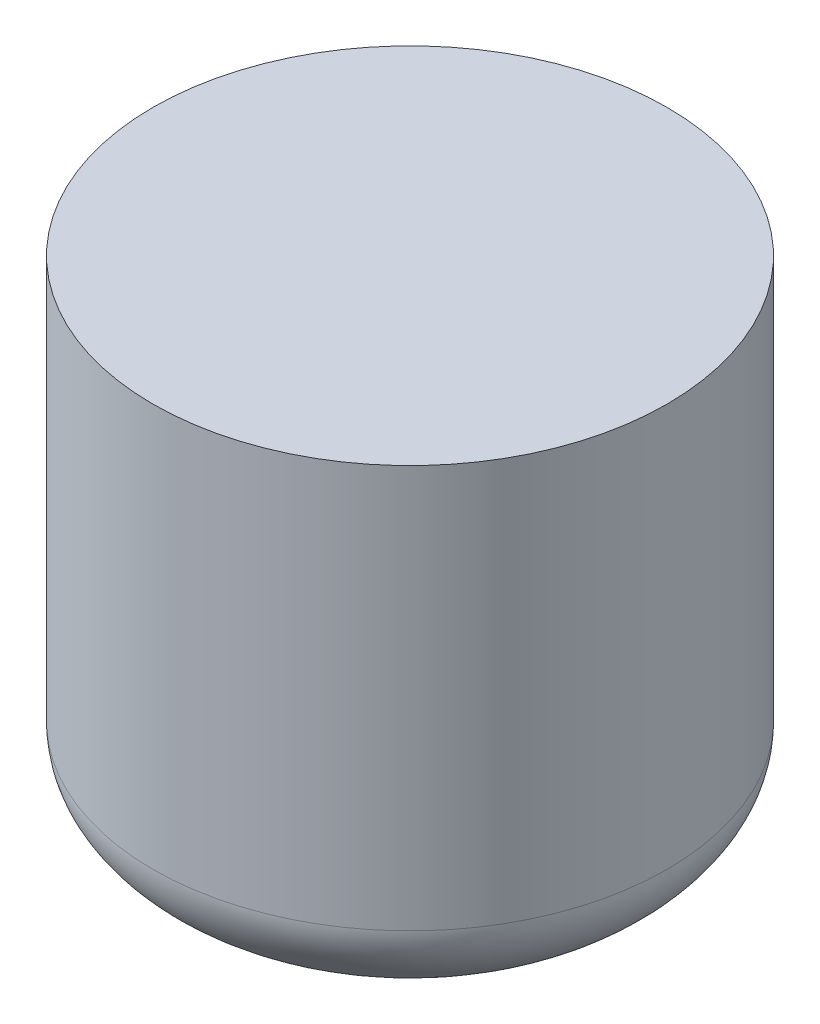
from build123d import *


with BuildPart() as part:
    # Sketch1 → Revolve1 (revolve)
    with BuildSketch(Plane.XY):
        with BuildLine():
            Line((0, 109.4994), (69.85, 109.4994))
            Line((69.85, 109.4994), (69.85, 0))
            add(Edge.make_bspline(
                [(0, -34.925), (69.85, -34.925), (69.85, 0)],
                knots=[1.570796327, 1.570796327, 1.570796327, 3.141592654, 3.141592654, 3.141592654], degree=2, weights=[1, 0.707106781, 1]))
            Line((0, -34.925), (0, 109.4994))
        make_face()
    revolve(axis=Axis((0, -34.925, 0), (0, 1, 0)))


solid = part.part
